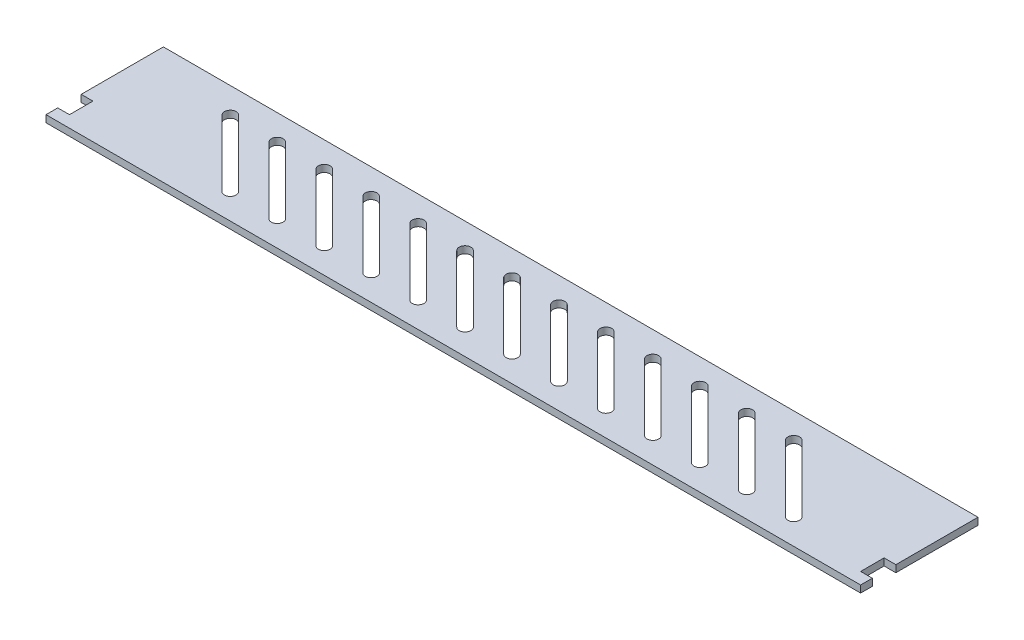
from build123d import *

# Parameters (mm, degrees)
SKETCH1_W           = 347
SKETCH1_H           = 50
EXTRUDE1_DEPTH      = 3
EXTRUDE2_DEPTH      = 176.317569
LPATTERN1_COUNT     = 7
LPATTERN1_PITCH     = 20
LPATTERN1_COL_COUNT = 7
LPATTERN1_COL_PITCH = 20
EXTRUDE3_REACH      = 177.318
SKETCH3_W           = 5
SKETCH3_H           = 10


with BuildPart() as part:
    # Sketch1 → Extrude1 (new body)
    with BuildSketch(Plane(origin=(0, 0, 0), x_dir=(1, 0, 0), z_dir=(0, 1, 0))):
        Rectangle(SKETCH1_W, SKETCH1_H)
    extrude(amount=EXTRUDE1_DEPTH)

    # Sketch2 → Extrude2 (cut, through all)
    with BuildSketch(Plane(origin=(0, 3, 0), x_dir=(1, 0, 0), z_dir=(0, 1, 0))):
        with BuildLine():
            Line((15.909902577, -12.374368671), (-12.374368671, 15.909902577))
            ThreePointArc((-12.374368671, 15.909902577), (-15.909902577, 15.909902577), (-15.909902577, 12.374368671))
            Line((-15.909902577, 12.374368671), (12.374368671, -15.909902577))
            ThreePointArc((12.374368671, -15.909902577), (15.909902577, -15.909902577), (15.909902577, -12.374368671))
        make_face()
    extrude2 = extrude(amount=-EXTRUDE2_DEPTH, mode=Mode.SUBTRACT)

    # LPattern1: Extrude2 ×7
    with Locations(*[(i * LPATTERN1_PITCH, 0, 0) for i in range(1, LPATTERN1_COUNT)]):
        add(extrude2, mode=Mode.SUBTRACT)

    # LPattern1 col: Extrude2 ×7
    with Locations(*[(-i * LPATTERN1_COL_PITCH, 0, 0) for i in range(1, LPATTERN1_COL_COUNT)]):
        add(extrude2, mode=Mode.SUBTRACT)

    # Sketch3 → Extrude3 (cut, up to next)
    with BuildSketch(Plane(origin=(0, 3, 0), x_dir=(1, 0, 0), z_dir=(0, 1, 0)), mode=Mode.PRIVATE) as extrude3_sk1:
        with Locations((-171, -15)):
            Rectangle(SKETCH3_W, SKETCH3_H)
    extrude3_tool1 = extrude(extrude3_sk1.sketch, amount=-EXTRUDE3_REACH, mode=Mode.PRIVATE) & part.part
    extrude3 = extrude3_tool1.solids().sort_by_distance((-171, 3, 15))[0]
    add(extrude3, mode=Mode.SUBTRACT)

    # Mirror1: Extrude3 across plane
    add(extrude3.mirror(Plane(origin=(0, 0, 0), x_dir=(0, 0, 1), z_dir=(1, 0, 0))), mode=Mode.SUBTRACT)


solid = part.part
